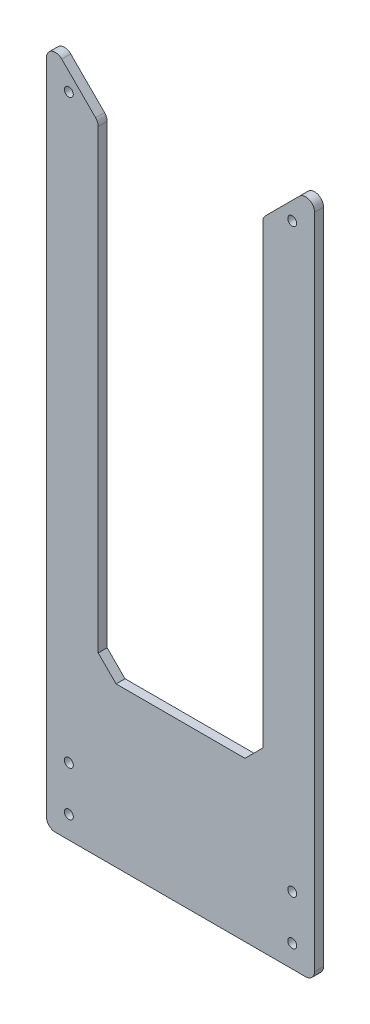
from build123d import *

# Parameters (mm, degrees)
MODEL_R             = 0.5
BOSS_EXTRUDE1_DEPTH = 1


with BuildPart() as part:
    # Model → Boss-Extrude1 (new body)
    with BuildSketch(Plane.XY):
        with BuildLine():
            Line((82.651854623, -0.999998655), (54.651854623, -0.999998655))
            ThreePointArc((54.651854623, -0.999998655), (53.944747842, -0.707105436), (53.651854623, 1.345e-06))
            Line((53.651854623, 1.345e-06), (53.651854623, 73.585787783))
            ThreePointArc((53.651854623, 73.585787783), (54.26917119, 74.509667315), (55.358961404, 74.292894564))
            Line((55.358961404, 74.292894564), (59.148961404, 70.502894564))
            ThreePointArc((59.148961404, 70.502894564), (59.365734155, 70.178471215), (59.441854623, 69.795787783))
            Line((59.441854623, 69.795787783), (59.441854623, 18.780001734))
            Line((59.441854623, 18.780001734), (61.441849513, 16.780001345))
            Line((61.441849513, 16.780001345), (75.861849513, 16.780001345))
            Line((75.861849513, 16.780001345), (77.861854623, 18.780001734))
            Line((77.861854623, 18.780001734), (77.861854623, 69.795787783))
            ThreePointArc((77.861854623, 69.795787783), (77.93797509, 70.178471215), (78.154747842, 70.502894564))
            Line((78.154747842, 70.502894564), (81.944747842, 74.292894564))
            ThreePointArc((81.944747842, 74.292894564), (83.034538055, 74.509667315), (83.651854623, 73.585787783))
            Line((83.651854623, 73.585787783), (83.651854623, 1.345e-06))
            ThreePointArc((83.651854623, 1.345e-06), (83.358961404, -0.707105436), (82.651854623, -0.999998655))
        make_face()
        with Locations((56.151854623, 6.500001345)):
            Circle(MODEL_R, mode=Mode.SUBTRACT)
        with Locations((56.151854623, 71.500001345)):
            Circle(MODEL_R, mode=Mode.SUBTRACT)
        with Locations((81.151854623, 6.500001345)):
            Circle(MODEL_R, mode=Mode.SUBTRACT)
        with Locations((81.151854623, 71.500001345)):
            Circle(MODEL_R, mode=Mode.SUBTRACT)
        with Locations((56.151854623, 1.500001345)):
            Circle(MODEL_R, mode=Mode.SUBTRACT)
        with Locations((81.151854623, 1.500001345)):
            Circle(MODEL_R, mode=Mode.SUBTRACT)
    extrude(amount=BOSS_EXTRUDE1_DEPTH)


solid = part.part
